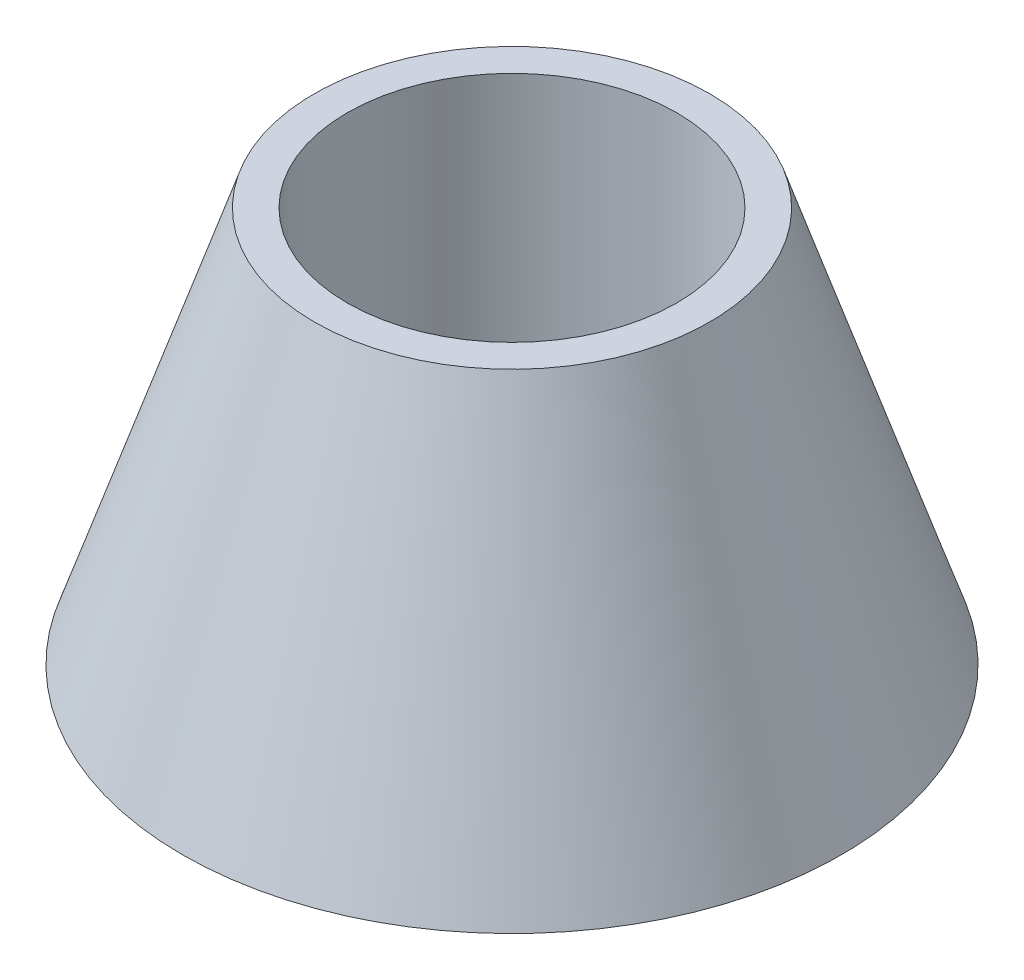
from build123d import *


with BuildPart() as part:
    # Szkic1 → Obrót1 (revolve)
    with BuildSketch(Plane.XY, mode=Mode.PRIVATE) as obr_t1_sk:
        Polygon((5, 0.755294412), (10, 0.755294412), (6, 12.755294412), (5, 12.755294412), align=None)
    revolve(obr_t1_sk.sketch.rotate(Axis((0, 0, 0), (0, 1, 0)), 90), axis=Axis((0, 0, 0), (0, 1, 0)))


solid = part.part
